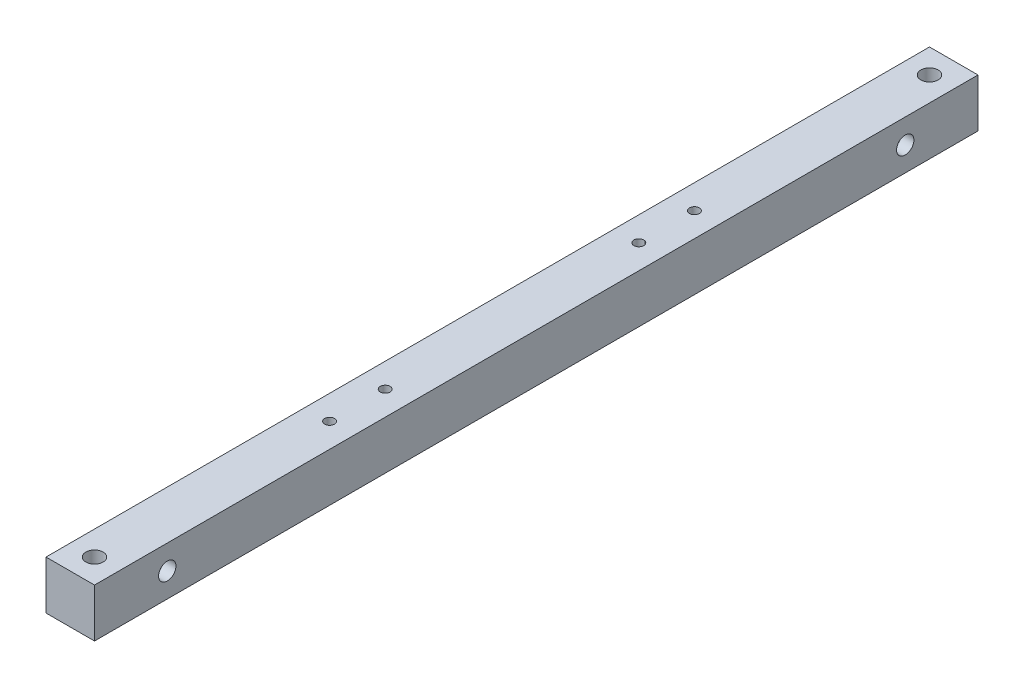
from build123d import *

# Parameters (mm, degrees)
IZIM1_W                     = 28
IZIM1_H                     = 28
Y_KSEKLIK_EKSTR_ZYON1_DEPTH = 255
IZIM2_R                     = 5
KES_EKSTR_ZYON1_DEPTH       = 7
KES_EKSTR_ZYON2_DEPTH       = 257.914382626
KES_EKSTR_ZYON2_DEPTH_BACK  = 257.914382626
IZIM3_R                     = 3
KES_EKSTR_ZYON3_REACH       = 258.914
IZIM4_R                     = 3
IZIM6_R                     = 5
KES_EKSTR_ZYON5_DEPTH       = 7
IZIM7_R                     = 2.85
KES_EKSTR_ZYON6_DEPTH       = 257.914382626


with BuildPart() as part:
    # Çizim1 → Yükseklik-Ekstrüzyon1 (new, symmetric)
    with BuildSketch(Plane.XY):
        Rectangle(IZIM1_W, IZIM1_H)
    extrude(amount=Y_KSEKLIK_EKSTR_ZYON1_DEPTH, both=True)

    # Çizim2 → Kes-Ekstrüzyon1 (cut)
    with BuildSketch(Plane(origin=(14, 0, 0), x_dir=(0, 0, -1), z_dir=(1, 0, 0))):
        with Locations((-213, 0)):
            Circle(IZIM2_R)
        with Locations((213, 0)):
            Circle(IZIM2_R)
    extrude(amount=-KES_EKSTR_ZYON1_DEPTH, mode=Mode.SUBTRACT)

    # Çizim3 → Kes-Ekstrüzyon2 (cut, two sides: drawn at the far end of the back side and taken through both)
    with BuildSketch(Plane(origin=(14, 0, 0), x_dir=(0, 0, -1), z_dir=(1, 0, 0)).offset(-KES_EKSTR_ZYON2_DEPTH_BACK)):
        with Locations((-213, 0)):
            Circle(IZIM3_R)
        with Locations((213, 0)):
            Circle(IZIM3_R)
    extrude(amount=KES_EKSTR_ZYON2_DEPTH + KES_EKSTR_ZYON2_DEPTH_BACK, mode=Mode.SUBTRACT)

    # Çizim4 → Kes-Ekstrüzyon3 (cut, up to next)
    with BuildSketch(Plane.XZ.offset(14), mode=Mode.PRIVATE) as kes_ekstr_zyon3_sk1:
        with Locations(Location((0, -241, 0), (0, 0, 270))):
            Circle(IZIM4_R)
    kes_ekstr_zyon3_tool1 = extrude(kes_ekstr_zyon3_sk1.sketch, amount=-KES_EKSTR_ZYON3_REACH, mode=Mode.PRIVATE) & part.part
    # Çizim4 → Kes-Ekstrüzyon3 (cut, up to next)
    with BuildSketch(Plane.XZ.offset(14), mode=Mode.PRIVATE) as kes_ekstr_zyon3_sk2:
        with Locations(Location((0, 241, 0), (0, 0, 270))):
            Circle(IZIM4_R)
    kes_ekstr_zyon3_tool2 = extrude(kes_ekstr_zyon3_sk2.sketch, amount=-KES_EKSTR_ZYON3_REACH, mode=Mode.PRIVATE) & part.part
    add(kes_ekstr_zyon3_tool1.solids().sort_by_distance((0, -14, -241))[0], mode=Mode.SUBTRACT)
    add(kes_ekstr_zyon3_tool2.solids().sort_by_distance((0, -14, 241))[0], mode=Mode.SUBTRACT)

    # Çizim6 → Kes-Ekstrüzyon5 (cut)
    with BuildSketch(Plane(origin=(0, 14, 0), x_dir=(1, 0, 0), z_dir=(0, 1, 0))):
        with Locations(Location((0, -241, 0), (0, 0, 270))):
            Circle(IZIM6_R)
        with Locations(Location((0, 241, 0), (0, 0, 270))):
            Circle(IZIM6_R)
    extrude(amount=-KES_EKSTR_ZYON5_DEPTH, mode=Mode.SUBTRACT)

    # Çizim7 → Kes-Ekstrüzyon6 (cut, through all)
    with BuildSketch(Plane(origin=(0, 14, 0), x_dir=(1, 0, 0), z_dir=(0, 1, 0))):
        with Locations(Location((0, -105.3, 0), (0, 0, 270))):
            Circle(IZIM7_R)
        with Locations(Location((0, -73.2, 0), (0, 0, 270))):
            Circle(IZIM7_R)
        with Locations(Location((0, 73.2, 0), (0, 0, 90))):
            Circle(IZIM7_R)
        with Locations(Location((0, 105.3, 0), (0, 0, 90))):
            Circle(IZIM7_R)
    extrude(amount=-KES_EKSTR_ZYON6_DEPTH, mode=Mode.SUBTRACT)


solid = part.part
